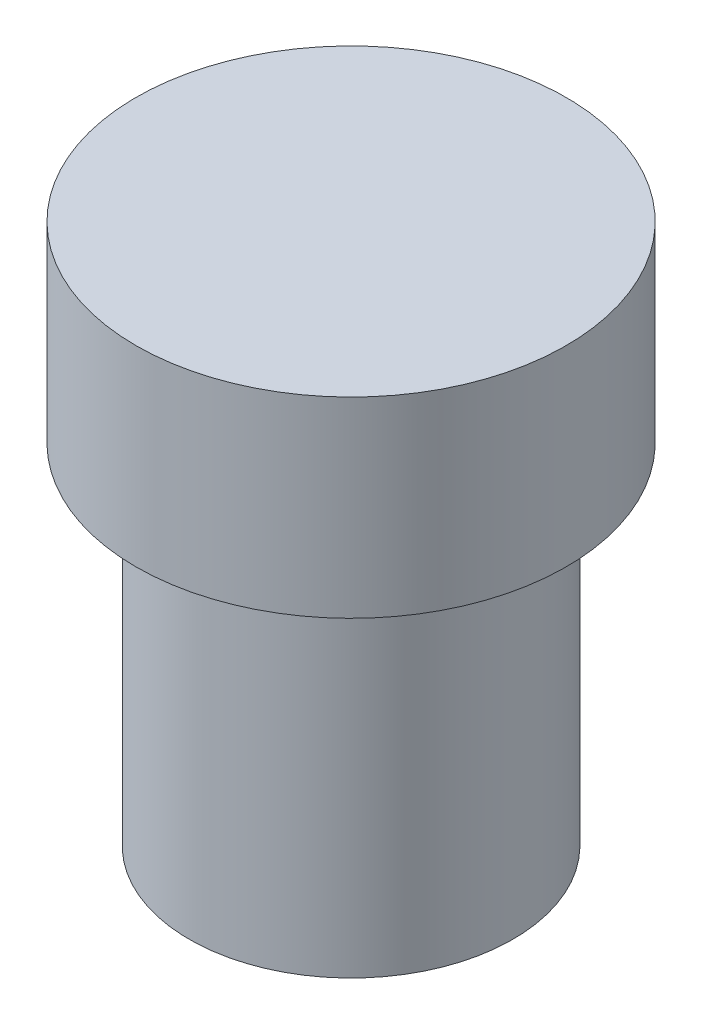
from build123d import *

# Parameters (mm, degrees)
ESBO_O1_R                = 5.05
RESSALTO_EXTRUS_O1_DEPTH = 4.5
ESBO_O2_R                = 3.8
RESSALTO_EXTRUS_O2_DEPTH = 8.2


with BuildPart() as part:
    # Esboço1 → Ressalto-extrusão1 (new body)
    with BuildSketch(Plane(origin=(0, 0, 0), x_dir=(1, 0, 0), z_dir=(0, 1, 0))):
        with Locations(Location((0, 0, 0), (0, 0, 270))):
            Circle(ESBO_O1_R)
    extrude(amount=RESSALTO_EXTRUS_O1_DEPTH)

    # Esboço2 → Ressalto-extrusão2 (add)
    with BuildSketch(Plane.XZ):
        with Locations(Location((0, 0, 0), (0, 0, 270))):
            Circle(ESBO_O2_R)
    extrude(amount=RESSALTO_EXTRUS_O2_DEPTH)


solid = part.part
